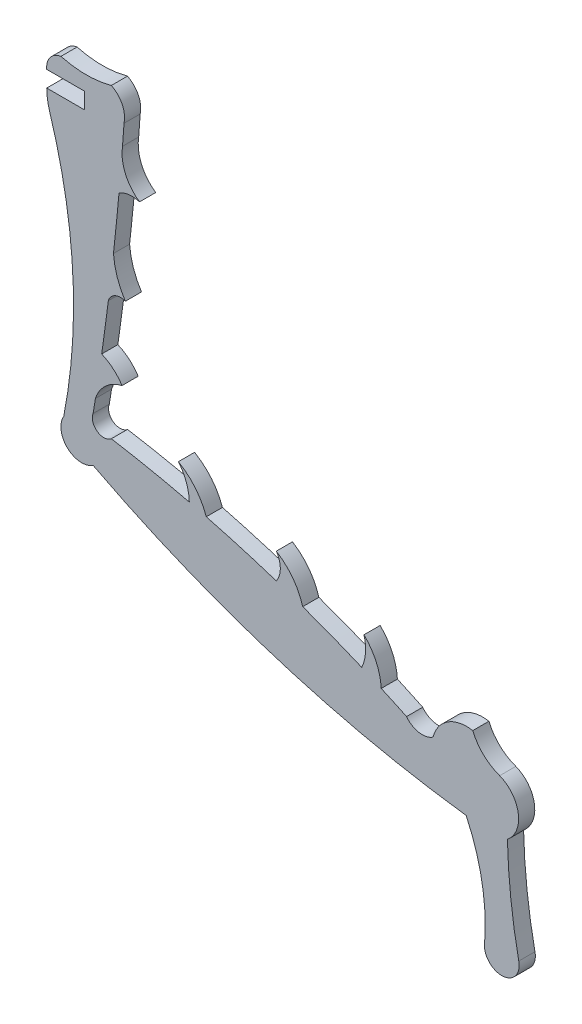
from build123d import *

# Parameters (mm, degrees)
BOSS_EXTRUDE1_DEPTH = 1.524


with BuildPart() as part:
    # Sketch1 → Boss-Extrude1 (new body)
    with BuildSketch(Plane.XY):
        with BuildLine():
            Line((25.899875794, 0), (25.899875794, -1.524))
            Line((25.899875794, -1.524), (22.32048354, -1.524))
            ThreePointArc((22.32048354, -1.524), (22.394704152, -2.448389179), (22.608367924, -3.350803633))
            ThreePointArc((22.608367924, -3.350803633), (24.775682693, -15.358642742), (23.925034543, -27.530818024))
            ThreePointArc((23.925034543, -27.530818024), (24.269313487, -29.941018013), (26.694765546, -30.152617376))
            ThreePointArc((26.694765546, -30.152617376), (43.800025443, -37.203050355), (61.874254559, -41.155361478))
            ThreePointArc((61.874254559, -41.155361478), (63.35881503, -45.79590736), (63.615238945, -50.661380887))
            ThreePointArc((63.615238945, -50.661380887), (65.284550388, -52.552507853), (66.8346767, -50.562515312))
            ThreePointArc((66.8346767, -50.562515312), (66.086863923, -45.883082095), (65.762862434, -41.155361478))
            ThreePointArc((65.762862434, -41.155361478), (66.787088001, -38.530646728), (65.033651376, -36.325283826))
            ThreePointArc((65.033651376, -36.325283826), (63.508505747, -35.385780492), (62.493571354, -33.909757498))
            ThreePointArc((62.493571354, -33.909757498), (60.142882659, -34.378985159), (58.743656643, -36.325283826))
            ThreePointArc((58.743656643, -36.325283826), (57.410289813, -36.601347141), (56.250770366, -35.887489516))
            ThreePointArc((56.250770366, -35.887489516), (55.059942052, -35.328446838), (53.862175702, -34.784427942))
            ThreePointArc((53.862175702, -34.784427942), (53.387744375, -32.845536507), (52.235990682, -31.215245578))
            ThreePointArc((52.235990682, -31.215245578), (52.379437809, -32.619080701), (52.025456966, -33.985106943))
            ThreePointArc((52.025456966, -33.985106943), (49.256787636, -32.858021413), (46.457035721, -31.810528756))
            ThreePointArc((46.457035721, -31.810528756), (45.520333016, -29.932577753), (43.969177054, -28.519061884))
            ThreePointArc((43.969177054, -28.519061884), (44.348322504, -29.737128844), (43.969177054, -30.955195804))
            ThreePointArc((43.969177054, -30.955195804), (40.682262853, -29.930853217), (37.363411838, -29.015260162))
            ThreePointArc((37.363411838, -29.015260162), (36.338596802, -27.1840345), (34.737637182, -25.82736152))
            ThreePointArc((34.737637182, -25.82736152), (35.485911293, -27.135318264), (35.76553834, -28.616018674))
            ThreePointArc((35.76553834, -28.616018674), (32.102551283, -27.80064259), (28.412668556, -27.117211688))
            ThreePointArc((28.412668556, -27.117211688), (27.08385139, -27.186040378), (26.694765546, -25.913599945))
            ThreePointArc((26.694765546, -25.913599945), (26.802310466, -25.249830728), (26.908212993, -24.585797492))
            ThreePointArc((26.908212993, -24.585797492), (27.859098363, -23.097961687), (29.420120996, -22.272706147))
            ThreePointArc((29.420120996, -22.272706147), (28.583123123, -21.317792963), (27.500905932, -20.653541067))
            ThreePointArc((27.500905932, -20.653541067), (27.824154163, -18.325383322), (28.127257878, -15.994517379))
            ThreePointArc((28.127257878, -15.994517379), (28.758910246, -15.256602171), (29.730007897, -15.234855434))
            ThreePointArc((29.730007897, -15.234855434), (28.962069061, -13.633439137), (28.611030242, -11.892452072))
            ThreePointArc((28.611030242, -11.892452072), (28.885875625, -9.28370644), (29.135532328, -6.672429877))
            ThreePointArc((29.135532328, -6.672429877), (30.079064964, -6.355518981), (31.070294126, -6.44580243))
            ThreePointArc((31.070294126, -6.44580243), (29.85894962, -5.077426559), (29.420124937, -3.303380072))
            ThreePointArc((29.420124937, -3.303380072), (29.431447758, -3.003641616), (29.466206898, -2.705710163))
            ThreePointArc((29.466206898, -2.705710163), (29.538300485, -1.73398118), (29.606910148, -0.762))
            ThreePointArc((29.606910148, -0.762), (29.438405233, 0.690848146), (28.412668556, 1.733453494))
            ThreePointArc((28.412668556, 1.733453494), (26.035003808, 1.415915884), (23.657339059, 1.733453494))
            ThreePointArc((23.657339059, 1.733453494), (22.643555103, 1.133068669), (22.32048354, 0))
            Line((22.32048354, 0), (25.899875794, 0))
        make_face()
    extrude(amount=BOSS_EXTRUDE1_DEPTH)


solid = part.part
